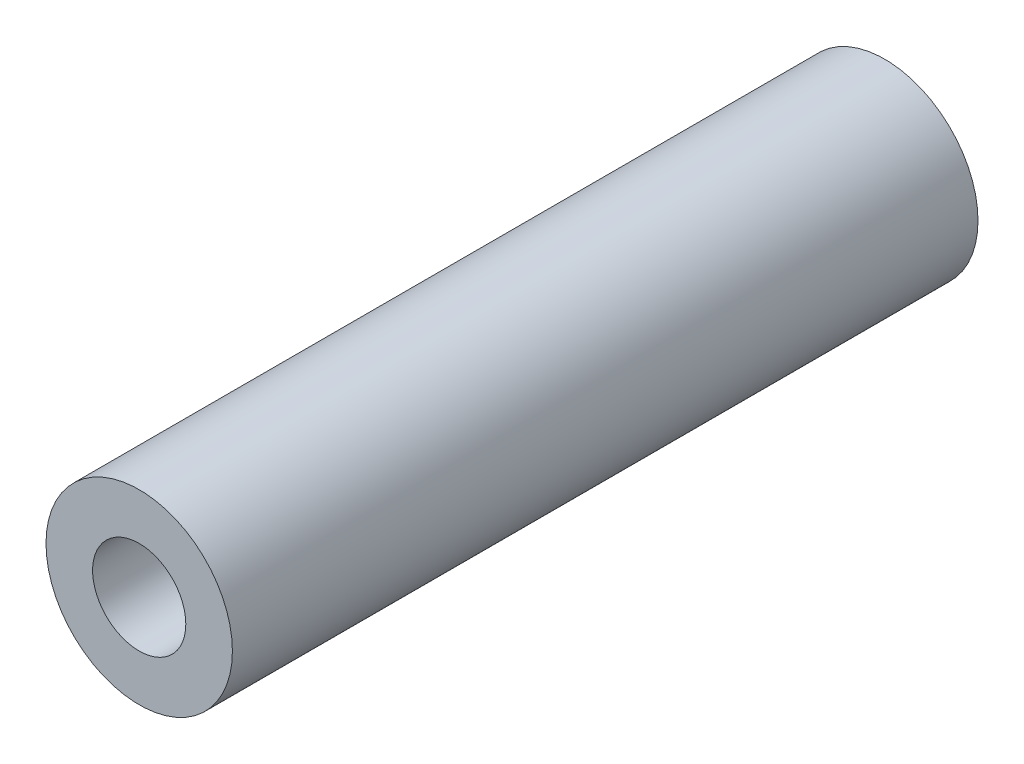
from build123d import *

# Parameters (mm, degrees)
SKETCH1_R           = 2.5
SKETCH1_R_2         = 1.25
BOSS_EXTRUDE1_DEPTH = 20


with BuildPart() as part:
    # Sketch1 → Boss-Extrude1 (new body)
    with BuildSketch(Plane.XY):
        with Locations((184.267611591, 120.119180009)):
            Circle(SKETCH1_R)
        with Locations((184.267611591, 120.119180009)):
            Circle(SKETCH1_R_2, mode=Mode.SUBTRACT)
    extrude(amount=BOSS_EXTRUDE1_DEPTH)


solid = part.part
